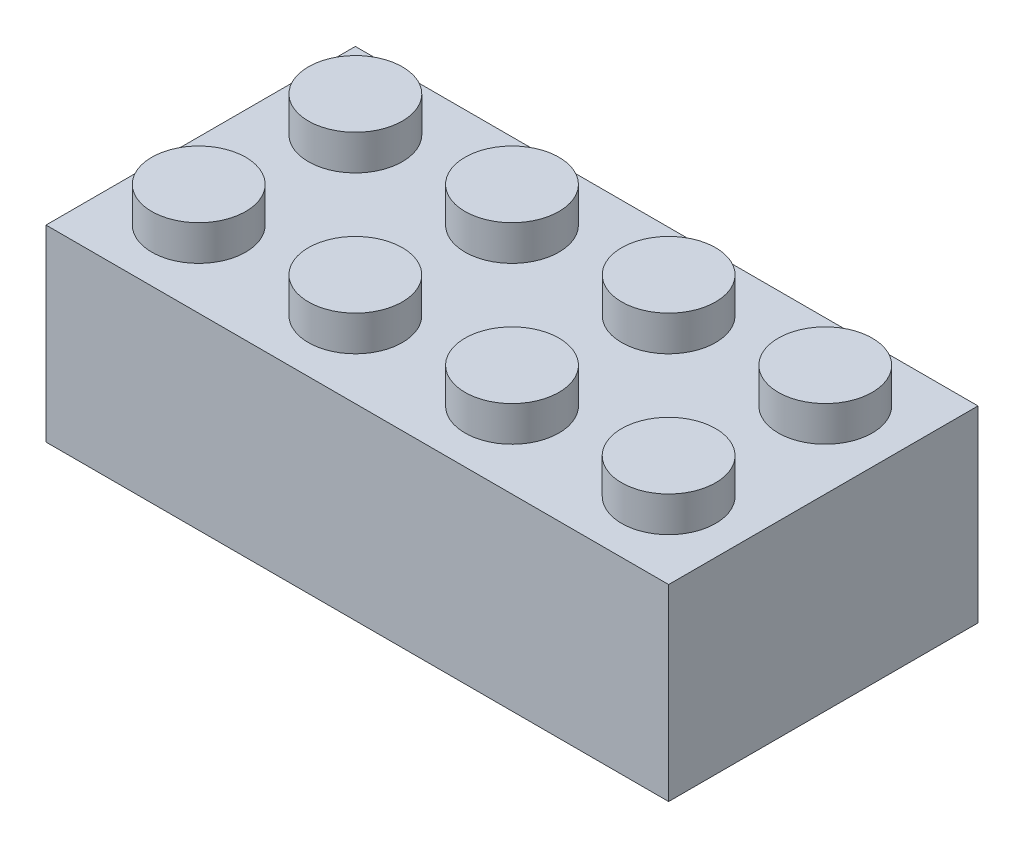
from build123d import *

# Parameters (mm, degrees)
SKETCH1_W           = 31.8
SKETCH1_H           = 15.8
BOSS_EXTRUDE1_DEPTH = 9.6
SKETCH2_R           = 2.4
BOSS_EXTRUDE2_DEPTH = 1.8
CUT_EXTRUDE8_DEPTH  = 8.6
SKETCH5_R           = 1.3
CUT_EXTRUDE9_DEPTH  = 1.7
SKETCH6_R           = 3.25
SKETCH6_R_2         = 2.05
BOSS_EXTRUDE3_DEPTH = 8.6
BOSS_EXTRUDE4_DEPTH = 6.3


with BuildPart() as part:
    # Sketch1 → Boss-Extrude1 (new body)
    with BuildSketch(Plane(origin=(0, 0, 0), x_dir=(1, 0, 0), z_dir=(0, 1, 0))):
        Rectangle(SKETCH1_W, SKETCH1_H)
    extrude(amount=BOSS_EXTRUDE1_DEPTH)

    # Sketch2 → Boss-Extrude2 (add)
    with BuildSketch(Plane(origin=(0, 9.6, 0), x_dir=(1, 0, 0), z_dir=(0, 1, 0))):
        with Locations(Location((-4, 4, 0), (0, 0, 270))):
            Circle(SKETCH2_R)
        with Locations(Location((-12, 4, 0), (0, 0, 270))):
            Circle(SKETCH2_R)
        with Locations(Location((4, 4, 0), (0, 0, 270))):
            Circle(SKETCH2_R)
        with Locations(Location((12, 4, 0), (0, 0, 270))):
            Circle(SKETCH2_R)
        with Locations(Location((12, -4, 0), (0, 0, 90))):
            Circle(SKETCH2_R)
        with Locations(Location((4, -4, 0), (0, 0, 90))):
            Circle(SKETCH2_R)
        with Locations(Location((-4, -4, 0), (0, 0, 90))):
            Circle(SKETCH2_R)
        with Locations(Location((-12, -4, 0), (0, 0, 90))):
            Circle(SKETCH2_R)
    extrude(amount=BOSS_EXTRUDE2_DEPTH)

    # Sketch4 → Cut-Extrude8 (cut)
    with BuildSketch(Plane(origin=(0, 0, 0), x_dir=(-1, 0, 0), z_dir=(0, -1, 0))):
        Polygon((14.7, 3.398716226), (14.7, -3.398716226), (14.5, -3.398716226), (14.5, -4.601283774), (14.7, -4.601283774), (14.7, -6.7), (12.6, -6.7), (12.6, -6.5), (11.4, -6.5), (11.4, -6.7), (4.601283774, -6.7), (4.601283774, -6.5), (3.398716226, -6.5), (3.398716226, -6.7), (-3.398716226, -6.7), (-3.398716226, -6.5), (-4.601283774, -6.5), (-4.601283774, -6.7), (-11.4, -6.7), (-11.4, -6.5), (-12.6, -6.5), (-12.6, -6.7), (-14.7, -6.7), (-14.7, -4.601283774), (-14.5, -4.601283774), (-14.5, -3.398716226), (-14.7, -3.398716226), (-14.7, 3.398716226), (-14.5, 3.398716226), (-14.5, 4.601283774), (-14.7, 4.601283774), (-14.7, 6.7), (-12.6, 6.7), (-12.6, 6.5), (-11.4, 6.5), (-11.4, 6.7), (-4.601283774, 6.7), (-4.601283774, 6.5), (-3.398716226, 6.5), (-3.398716226, 6.7), (3.398716226, 6.7), (3.398716226, 6.5), (4.601283774, 6.5), (4.601283774, 6.7), (11.4, 6.7), (11.4, 6.5), (12.6, 6.5), (12.6, 6.7), (14.7, 6.7), (14.7, 4.601283774), (14.5, 4.601283774), (14.5, 3.398716226), align=None)
    extrude(amount=-CUT_EXTRUDE8_DEPTH, mode=Mode.SUBTRACT)

    # Sketch5 → Cut-Extrude9 (cut)
    with BuildSketch(Plane(origin=(0, 8.6, 0), x_dir=(-1, 0, 0), z_dir=(0, -1, 0))):
        with Locations(Location((12, -4, 0), (0, 0, 90))):
            Circle(SKETCH5_R)
        with Locations(Location((4, -4, 0), (0, 0, 90))):
            Circle(SKETCH5_R)
        with Locations(Location((-4, -4, 0), (0, 0, 90))):
            Circle(SKETCH5_R)
        with Locations(Location((-12, -4, 0), (0, 0, 90))):
            Circle(SKETCH5_R)
        with Locations(Location((4, 4, 0), (0, 0, 90))):
            Circle(SKETCH5_R)
        with Locations(Location((-4, 4, 0), (0, 0, 90))):
            Circle(SKETCH5_R)
        with Locations(Location((-12, 4, 0), (0, 0, 90))):
            Circle(SKETCH5_R)
        with Locations(Location((12, 4, 0), (0, 0, 90))):
            Circle(SKETCH5_R)
    extrude(amount=-CUT_EXTRUDE9_DEPTH, mode=Mode.SUBTRACT)

    # Sketch6 → Boss-Extrude3 (add)
    # profile 1 of 3: a face of its own
    with BuildSketch(Plane(origin=(0, 8.6, 0), x_dir=(-1, 0, 0), z_dir=(0, -1, 0))):
        with Locations(Location((0, 0, 0), (0, 0, 270))):
            Circle(SKETCH6_R)
        with Locations(Location((0, 0, 0), (0, 0, 270))):
            Circle(SKETCH6_R_2, mode=Mode.SUBTRACT)
    # profile 2 of 3: a face of its own
    with BuildSketch(Plane(origin=(0, 8.6, 0), x_dir=(-1, 0, 0), z_dir=(0, -1, 0))):
        with Locations(Location((8, 0, 0), (0, 0, 270))):
            Circle(SKETCH6_R)
        with Locations(Location((8, 0, 0), (0, 0, 270))):
            Circle(SKETCH6_R_2, mode=Mode.SUBTRACT)
    # profile 3 of 3: a face of its own
    with BuildSketch(Plane(origin=(0, 8.6, 0), x_dir=(-1, 0, 0), z_dir=(0, -1, 0))):
        with Locations(Location((-8, 0, 0), (0, 0, 270))):
            Circle(SKETCH6_R)
        with Locations(Location((-8, 0, 0), (0, 0, 270))):
            Circle(SKETCH6_R_2, mode=Mode.SUBTRACT)
    extrude(amount=BOSS_EXTRUDE3_DEPTH)

    # Sketch7 → Boss-Extrude4 (add)
    with BuildSketch(Plane(origin=(0, 8.6, 0), x_dir=(-1, 0, 0), z_dir=(0, -1, 0))):
        with BuildLine():
            Line((0.55, -3.203123476), (0.55, -6.7))
            Line((0.55, -6.7), (-0.55, -6.7))
            Line((-0.55, -6.7), (-0.55, -3.203123476))
            ThreePointArc((-0.55, -3.203123476), (0, -3.25), (0.55, -3.203123476))
        make_face()
        with BuildLine():
            Line((-0.55, 6.7), (-0.55, 3.203123476))
            ThreePointArc((-0.55, 3.203123476), (0, 3.25), (0.55, 3.203123476))
            Line((0.55, 3.203123476), (0.55, 6.7))
            Line((0.55, 6.7), (-0.55, 6.7))
        make_face()
    extrude(amount=BOSS_EXTRUDE4_DEPTH)


solid = part.part
